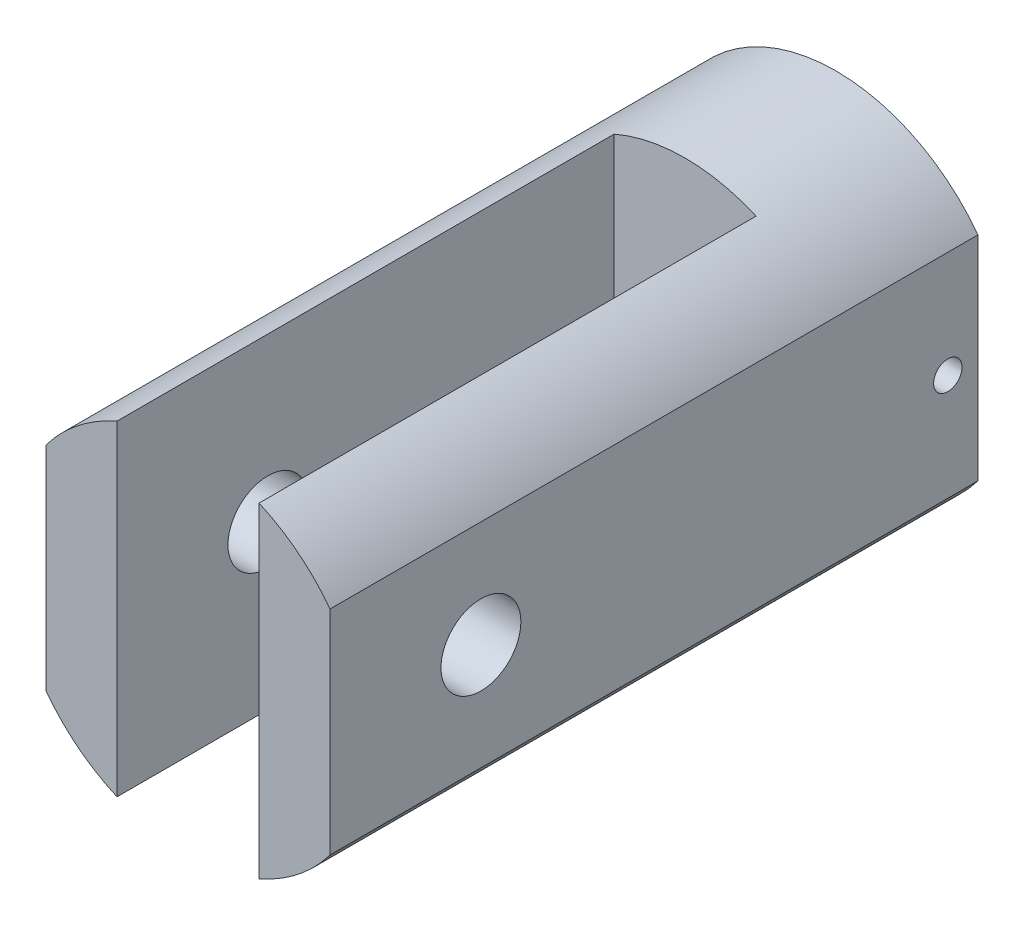
from build123d import *

# Parameters (mm, degrees)
SKETCH_1_R               = 10
EXTRUDE_2_DEPTH          = 36.5
CUT_EXTRUDE_1_DEPTH      = 40.143965052
CUT_EXTRUDE_1_DEPTH_BACK = 40.143965052
SKETCH_3_W               = 8
SKETCH_3_H               = 28
CUT_EXTRUDE_2_DEPTH      = 40.143965052
CUT_EXTRUDE_2_DEPTH_BACK = 40.143965052
SKETCH_4_W               = 2
SKETCH_4_H               = 36.5
CUT_EXTRUDE_4_DEPTH      = 39.681390875
CUT_EXTRUDE_4_DEPTH_BACK = 39.681390875
SKETCH_6_R               = 2.25
SKETCH_7_R               = 2.85
CUT_EXTRUDE_5_DEPTH      = 3.8
SKETCH_8_R               = 0.8
CUT_EXTRUDE_6_DEPTH      = 42.088319508


with BuildPart() as part:
    # 草图1 → 凸台-拉伸2 (new body)
    with BuildSketch(Plane.XY):
        Circle(SKETCH_1_R)
    extrude(amount=EXTRUDE_2_DEPTH)

    # 草图3 → 切除-拉伸1 (cut, two sides: drawn at the far end of the back side and taken through both)
    with BuildSketch(Plane(origin=(0, 0, 0), x_dir=(1, 0, 0), z_dir=(0, 1, 0)).offset(-CUT_EXTRUDE_1_DEPTH_BACK)):
        with Locations((0, -22.5)):
            Rectangle(SKETCH_3_W, SKETCH_3_H)
    extrude(amount=CUT_EXTRUDE_1_DEPTH + CUT_EXTRUDE_1_DEPTH_BACK, mode=Mode.SUBTRACT)

    # 草图4 → 切除-拉伸2 (cut, two sides: drawn at the far end of the back side and taken through both)
    with BuildSketch(Plane(origin=(0, 0, 0), x_dir=(1, 0, 0), z_dir=(0, 1, 0)).offset(-CUT_EXTRUDE_2_DEPTH_BACK)):
        with Locations((-9, -18.25)):
            Rectangle(SKETCH_4_W, SKETCH_4_H)
        with Locations((9, -18.25)):
            Rectangle(SKETCH_4_W, SKETCH_4_H)
    extrude(amount=CUT_EXTRUDE_2_DEPTH + CUT_EXTRUDE_2_DEPTH_BACK, mode=Mode.SUBTRACT)

    # 草图6 → 切除-拉伸4 (cut, two sides: drawn at the far end of the back side and taken through both)
    with BuildSketch(Plane(origin=(0, 0, 0), x_dir=(0, 0, -1), z_dir=(1, 0, 0)).offset(-CUT_EXTRUDE_4_DEPTH_BACK)):
        with Locations((-28, 0)):
            Circle(SKETCH_6_R)
    extrude(amount=CUT_EXTRUDE_4_DEPTH + CUT_EXTRUDE_4_DEPTH_BACK, mode=Mode.SUBTRACT)

    # 草图7 → 切除-拉伸5 (cut)
    with BuildSketch(Plane(origin=(0, 0, 0), x_dir=(-1, 0, 0), z_dir=(0, 0, -1))):
        Circle(SKETCH_7_R)
    extrude(amount=-CUT_EXTRUDE_5_DEPTH, mode=Mode.SUBTRACT)

    # 草图8 → 切除-拉伸6 (cut, through all)
    with BuildSketch(Plane.ZY.offset(8)):
        with Locations((1.7, 0)):
            Circle(SKETCH_8_R)
    extrude(amount=-CUT_EXTRUDE_6_DEPTH, mode=Mode.SUBTRACT)


solid = part.part
